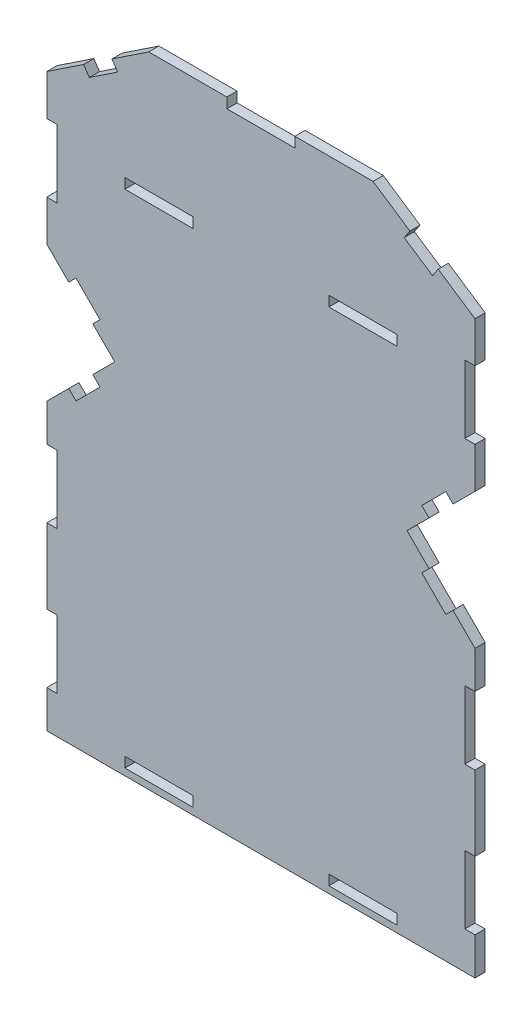
from build123d import *

# Parameters (mm, degrees)
SKETCH1_W           = 20
SKETCH1_H           = 3
BOSS_EXTRUDE1_DEPTH = 3


with BuildPart() as part:
    # Sketch1 → Boss-Extrude1 (new body)
    with BuildSketch(Plane.XY):
        Polygon((62.274694919, 0), (62.274694919, -11), (59.274694919, -11), (59.274694919, -31), (62.274694919, -31), (62.274694919, -53), (59.274694919, -53), (59.274694919, -73), (62.274694919, -73), (62.274694919, -84), (-63.725305081, -84), (-63.725305081, -73), (-60.725305081, -73), (-60.725305081, -53), (-63.725305081, -53), (-63.725305081, -31), (-60.725305081, -31), (-60.725305081, -11), (-63.725305081, -11), (-63.725305081, 0), (-57.260838987, 6.464466094), (-55.139518643, 4.343145751), (-48.068450831, 11.414213562), (-50.189771175, 13.535533906), (-43.725305081, 20), (-50.189771175, 26.464466094), (-48.068450831, 28.585786438), (-55.139518643, 35.656854249), (-57.260838987, 33.535533906), (-63.725305081, 40), (-63.725305081, 52), (-60.725305081, 52), (-60.725305081, 72), (-63.725305081, 72), (-63.725305081, 84), (-52.885556553, 91.226499019), (-51.221455964, 88.730348136), (-42.90095302, 94.277350098), (-44.565053609, 96.773500981), (-33.725305081, 104), (-10.725305081, 104), (-10.725305081, 101), (9.274694919, 101), (9.274694919, 104), (32.274694919, 104), (43.114443447, 96.773500981), (41.450342859, 94.277350098), (49.770845802, 88.730348136), (51.434946391, 91.226499019), (62.274694919, 84), (62.274694919, 72), (59.274694919, 72), (59.274694919, 52), (62.274694919, 52), (62.274694919, 40), (55.810228825, 33.535533906), (53.688908482, 35.656854249), (46.61784067, 28.585786438), (48.739161013, 26.464466094), (42.274694919, 20), (48.739161013, 13.535533906), (46.61784067, 11.414213562), (53.688908482, 4.343145751), (55.810228825, 6.464466094), align=None)
        with Locations((29.274694919, -80.5)):
            Rectangle(SKETCH1_W, SKETCH1_H, mode=Mode.SUBTRACT)
        with Locations((-30.725305081, -80.5)):
            Rectangle(SKETCH1_W, SKETCH1_H, mode=Mode.SUBTRACT)
        with Locations((29.274694919, 67)):
            Rectangle(SKETCH1_W, SKETCH1_H, mode=Mode.SUBTRACT)
        with Locations((-30.725305081, 67)):
            Rectangle(SKETCH1_W, SKETCH1_H, mode=Mode.SUBTRACT)
    extrude(amount=BOSS_EXTRUDE1_DEPTH)


solid = part.part
